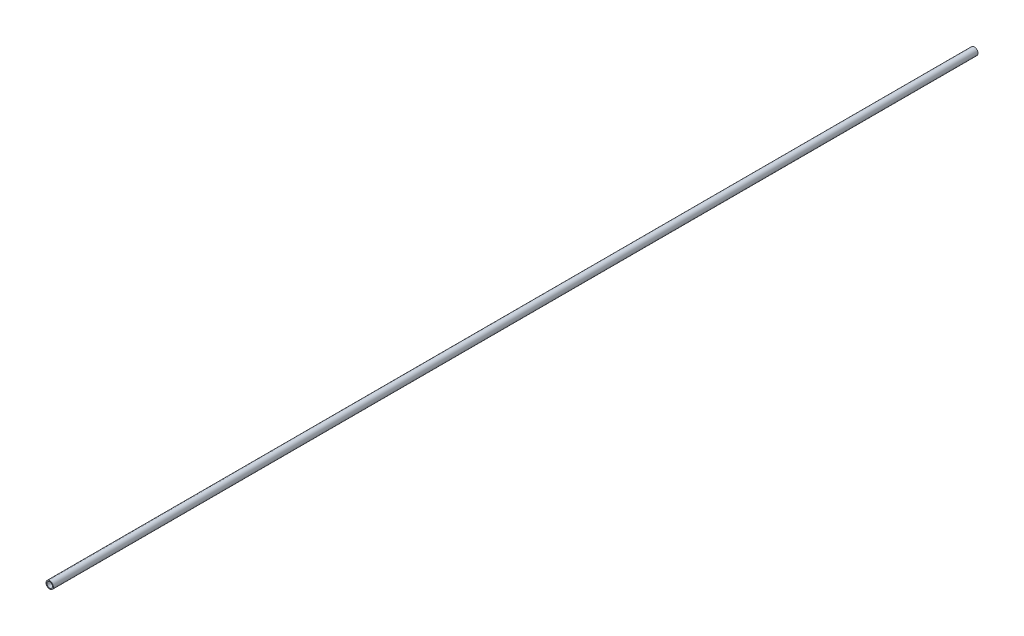
from build123d import *

# Parameters (mm, degrees)
SKETCH_1_R      = 4
SKETCH_1_R_2    = 3
EXTRUDE_1_DEPTH = 500


with BuildPart() as part:
    # Эскиз1 → Бобышка-Вытянуть1 (new, symmetric)
    with BuildSketch(Plane.XY):
        Circle(SKETCH_1_R)
        Circle(SKETCH_1_R_2, mode=Mode.SUBTRACT)
    extrude(amount=EXTRUDE_1_DEPTH, both=True)


solid = part.part
